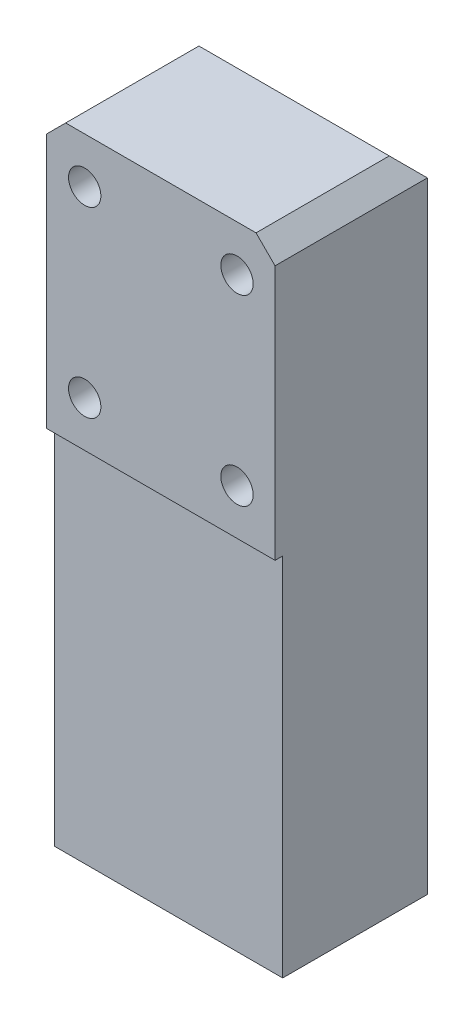
from build123d import *

# Parameters (mm, degrees)
SALIENTE_EXTRUIR1_DEPTH      = 30
SALIENTE_EXTRUIR1_DEPTH_BACK = 30
CHAFL_N1_SIZE                = 5
CHAFL_N2_SIZE                = 5
CROQUIS2_R                   = 6.5
CORTAR_EXTRUIR1_DEPTH        = 9
CORTAR_EXTRUIR2_REACH        = 175.45
CROQUIS3_R                   = 4.25
CROQUIS4_R                   = 4
CORTAR_EXTRUIR3_DEPTH        = 30


with BuildPart() as part:
    # Croquis1 → Saliente-Extruir1 (new, two sides: drawn at the far end of the back side and taken through both)
    with BuildSketch(Plane(origin=(0, 0, 0), x_dir=(0, 0, -1), z_dir=(1, 0, 0)).offset(-SALIENTE_EXTRUIR1_DEPTH_BACK)):
        Polygon((0, 0), (-40, 0), (-40, -72), (-38, -72), (-38, -168), (0, -168), align=None)
    extrude(amount=SALIENTE_EXTRUIR1_DEPTH + SALIENTE_EXTRUIR1_DEPTH_BACK)

    # Chaflán1
    chafl_n1_edges = [part.edges().sort_by_distance(p)[0] for p in [
        (0, 0, 0),
    ]]
    chamfer(chafl_n1_edges, length=CHAFL_N1_SIZE)

    # Chaflán2
    chafl_n2_edges = [part.edges().sort_by_distance(p)[0] for p in [
        (30, 0, 22.5),
        (-30, 0, 22.5),
    ]]
    chamfer(chafl_n2_edges, length=CHAFL_N2_SIZE)

    # Croquis2 → Cortar-Extruir1 (cut)
    with BuildSketch(Plane(origin=(0, 0, 0), x_dir=(-1, 0, 0), z_dir=(0, 0, -1))):
        with Locations((-20, -12)):
            Circle(CROQUIS2_R)
        with Locations((20, -12)):
            Circle(CROQUIS2_R)
        with Locations((-20, -60)):
            Circle(CROQUIS2_R)
        with Locations((20, -60)):
            Circle(CROQUIS2_R)
    extrude(amount=-CORTAR_EXTRUIR1_DEPTH, mode=Mode.SUBTRACT)

    # Croquis3 → Cortar-Extruir2 (cut, up to next)
    with BuildSketch(Plane(origin=(0, 0, 9), x_dir=(-1, 0, 0), z_dir=(0, 0, -1)), mode=Mode.PRIVATE) as cortar_extruir2_sk1:
        with Locations((-20, -12)):
            Circle(CROQUIS3_R)
    cortar_extruir2_tool1 = extrude(cortar_extruir2_sk1.sketch, amount=-CORTAR_EXTRUIR2_REACH, mode=Mode.PRIVATE) & part.part
    # Croquis3 → Cortar-Extruir2 (cut, up to next)
    with BuildSketch(Plane(origin=(0, 0, 9), x_dir=(-1, 0, 0), z_dir=(0, 0, -1)), mode=Mode.PRIVATE) as cortar_extruir2_sk2:
        with Locations((20, -12)):
            Circle(CROQUIS3_R)
    cortar_extruir2_tool2 = extrude(cortar_extruir2_sk2.sketch, amount=-CORTAR_EXTRUIR2_REACH, mode=Mode.PRIVATE) & part.part
    # Croquis3 → Cortar-Extruir2 (cut, up to next)
    with BuildSketch(Plane(origin=(0, 0, 9), x_dir=(-1, 0, 0), z_dir=(0, 0, -1)), mode=Mode.PRIVATE) as cortar_extruir2_sk3:
        with Locations((20, -60)):
            Circle(CROQUIS3_R)
    cortar_extruir2_tool3 = extrude(cortar_extruir2_sk3.sketch, amount=-CORTAR_EXTRUIR2_REACH, mode=Mode.PRIVATE) & part.part
    # Croquis3 → Cortar-Extruir2 (cut, up to next)
    with BuildSketch(Plane(origin=(0, 0, 9), x_dir=(-1, 0, 0), z_dir=(0, 0, -1)), mode=Mode.PRIVATE) as cortar_extruir2_sk4:
        with Locations((-20, -60)):
            Circle(CROQUIS3_R)
    cortar_extruir2_tool4 = extrude(cortar_extruir2_sk4.sketch, amount=-CORTAR_EXTRUIR2_REACH, mode=Mode.PRIVATE) & part.part
    add(cortar_extruir2_tool1.solids().sort_by_distance((20, -12, 9))[0], mode=Mode.SUBTRACT)
    add(cortar_extruir2_tool2.solids().sort_by_distance((-20, -12, 9))[0], mode=Mode.SUBTRACT)
    add(cortar_extruir2_tool3.solids().sort_by_distance((-20, -60, 9))[0], mode=Mode.SUBTRACT)
    add(cortar_extruir2_tool4.solids().sort_by_distance((20, -60, 9))[0], mode=Mode.SUBTRACT)

    # Croquis4 → Cortar-Extruir3 (cut)
    with BuildSketch(Plane.XZ.offset(168)):
        with Locations((-22, 30)):
            Circle(CROQUIS4_R)
        with Locations((-22, 8)):
            Circle(CROQUIS4_R)
        with Locations((22, 30)):
            Circle(CROQUIS4_R)
        with Locations((22, 8)):
            Circle(CROQUIS4_R)
    extrude(amount=-CORTAR_EXTRUIR3_DEPTH, mode=Mode.SUBTRACT)


solid = part.part
